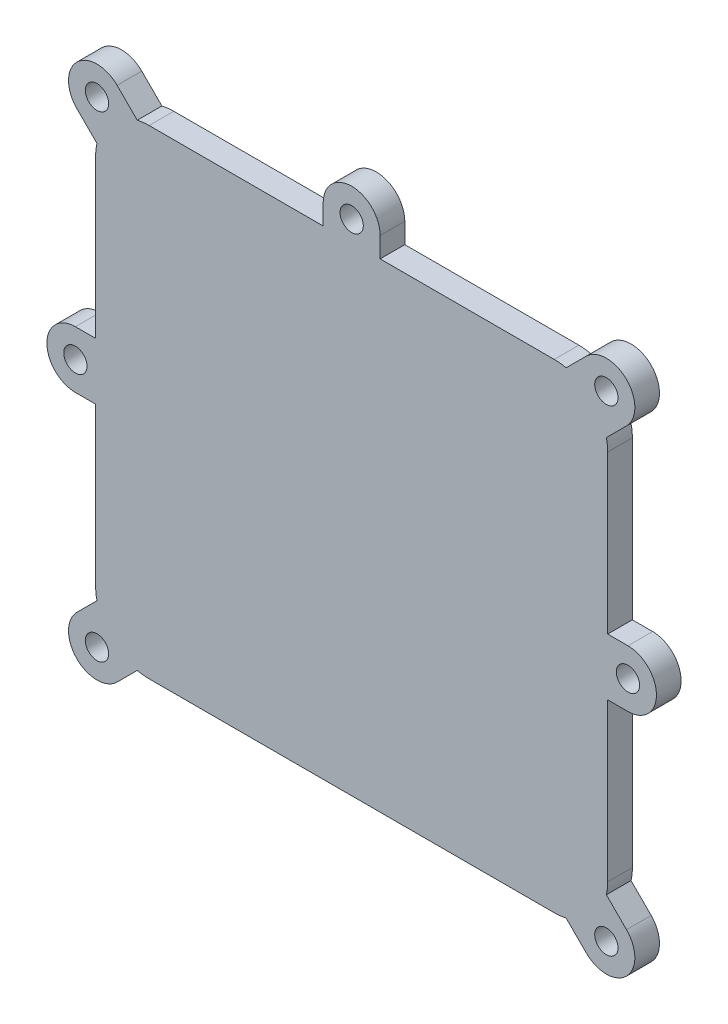
from build123d import *

# Parameters (mm, degrees)
BOSS_EXTRUDE1_DEPTH  = 4.7625
M4_CLEARANCE_HOLE1_D = 4.5


with BuildPart() as part:
    # Sketch1 → Boss-Extrude1 (new body)
    with BuildSketch(Plane.XY):
        with BuildLine():
            Line((288.228651321, -1867.207577199), (284.343172474, -1871.093056046))
            ThreePointArc((284.343172474, -1871.093056046), (283.201800398, -1870.89932849), (282.045921758, -1870.834481355))
            Line((282.045921758, -1870.834481355), (248.429921758, -1870.834481355))
            Line((248.429921758, -1870.834481355), (248.429921758, -1866.924781355))
            ThreePointArc((248.429921758, -1866.924781355), (242.929921758, -1861.424781355), (237.429921758, -1866.924781355))
            Line((237.429921758, -1866.924781355), (237.429921758, -1870.834481355))
            Line((237.429921758, -1870.834481355), (203.813921758, -1870.834481355))
            ThreePointArc((203.813921758, -1870.834481355), (202.658043118, -1870.89932849), (201.516671043, -1871.093056046))
            Line((201.516671043, -1871.093056046), (197.631192196, -1867.207577199))
            ThreePointArc((197.631192196, -1867.207577199), (189.853017603, -1867.207577199), (189.853017603, -1874.985751792))
            Line((189.853017603, -1874.985751792), (193.73849645, -1878.871230639))
            ThreePointArc((193.73849645, -1878.871230639), (193.544768893, -1880.012602715), (193.479921758, -1881.168481355))
            Line((193.479921758, -1881.168481355), (193.479921758, -1911.609481355))
            Line((193.479921758, -1911.609481355), (189.570221758, -1911.609481355))
            ThreePointArc((189.570221758, -1911.609481355), (184.070221758, -1917.109481355), (189.570221758, -1922.609481355))
            Line((189.570221758, -1922.609481355), (193.479921758, -1922.609481355))
            Line((193.479921758, -1922.609481355), (193.479921758, -1953.050481355))
            ThreePointArc((193.479921758, -1953.050481355), (193.544768893, -1954.206359995), (193.73849645, -1955.347732071))
            Line((193.73849645, -1955.347732071), (189.853017603, -1959.233210918))
            ThreePointArc((189.853017603, -1959.233210918), (189.853017603, -1967.011385511), (197.631192196, -1967.011385511))
            Line((197.631192196, -1967.011385511), (201.516671043, -1963.125906664))
            ThreePointArc((201.516671043, -1963.125906664), (202.658043118, -1963.31963422), (203.813921758, -1963.384481355))
            Line((203.813921758, -1963.384481355), (282.045921758, -1963.384481355))
            ThreePointArc((282.045921758, -1963.384481355), (283.201800398, -1963.31963422), (284.343172474, -1963.125906664))
            Line((284.343172474, -1963.125906664), (288.228651321, -1967.011385511))
            ThreePointArc((288.228651321, -1967.011385511), (296.006825914, -1967.011385511), (296.006825914, -1959.233210918))
            Line((296.006825914, -1959.233210918), (292.121347067, -1955.347732071))
            ThreePointArc((292.121347067, -1955.347732071), (292.315074623, -1954.206359995), (292.379921758, -1953.050481355))
            Line((292.379921758, -1953.050481355), (292.379921758, -1922.609481355))
            Line((292.379921758, -1922.609481355), (296.289621758, -1922.609481355))
            ThreePointArc((296.289621758, -1922.609481355), (301.789621758, -1917.109481355), (296.289621758, -1911.609481355))
            Line((296.289621758, -1911.609481355), (292.379921758, -1911.609481355))
            Line((292.379921758, -1911.609481355), (292.379921758, -1881.168481355))
            ThreePointArc((292.379921758, -1881.168481355), (292.315074623, -1880.012602715), (292.121347067, -1878.871230639))
            Line((292.121347067, -1878.871230639), (296.006825914, -1874.985751792))
            ThreePointArc((296.006825914, -1874.985751792), (296.006825914, -1867.207577199), (288.228651321, -1867.207577199))
        make_face()
    extrude(amount=BOSS_EXTRUDE1_DEPTH)

    # M4 Clearance Hole1 (through all)
    with Locations(Plane.XY.offset(4.7625)):
        with Locations((193.742104899, -1963.122298214), (189.570221758, -1917.109481355), (193.742104899, -1871.096664496), (242.929921758, -1866.924781355), (292.117738617, -1871.096664496), (296.289621758, -1917.109481355), (292.117738617, -1963.122298214)):
            Hole(M4_CLEARANCE_HOLE1_D / 2)


solid = part.part
